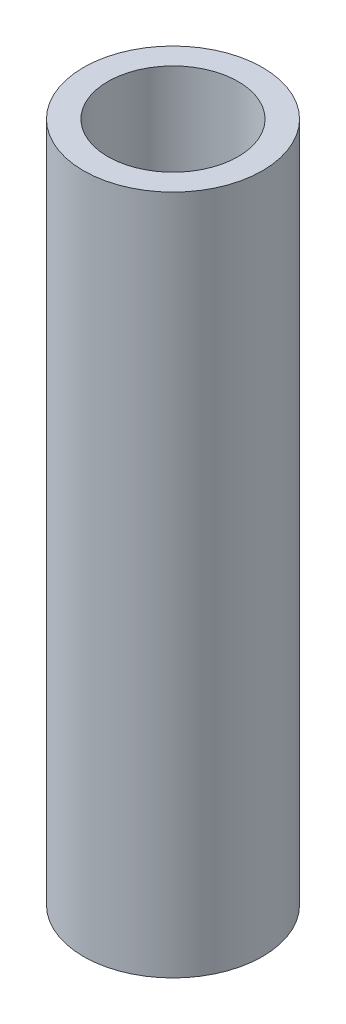
from build123d import *

# Parameters (mm, degrees)
SKETCH1_R           = 33.401
SKETCH1_R_2         = 24.3078
BOSS_EXTRUDE1_DEPTH = 127


with BuildPart() as part:
    # Sketch1 → Boss-Extrude1 (new, symmetric)
    with BuildSketch(Plane(origin=(0, 0, 0), x_dir=(1, 0, 0), z_dir=(0, 1, 0))):
        with Locations(Location((0, 0, 0), (0, 0, 270))):
            Circle(SKETCH1_R)
        with Locations(Location((0, 0, 0), (0, 0, 270))):
            Circle(SKETCH1_R_2, mode=Mode.SUBTRACT)
    extrude(amount=BOSS_EXTRUDE1_DEPTH, both=True)


solid = part.part
